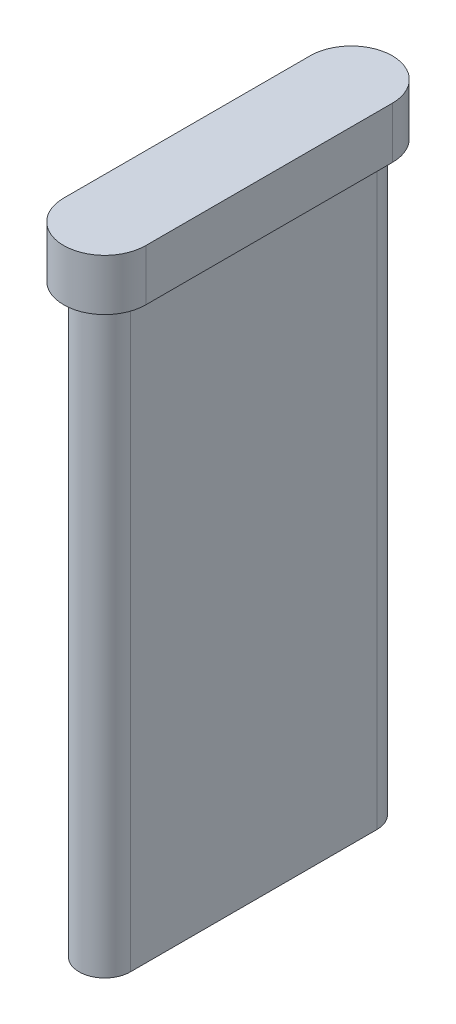
from build123d import *

# Parameters (mm, degrees)
BOSS_EXTRUDE1_DEPTH = 62
BOSS_EXTRUDE2_DEPTH = 5


with BuildPart() as part:
    # Sketch1 → Boss-Extrude1 (new body)
    with BuildSketch(Plane(origin=(0, 0, 0), x_dir=(1, 0, 0), z_dir=(0, 1, 0))):
        with BuildLine():
            Line((-2.5, -12), (-2.5, 12))
            ThreePointArc((-2.5, 12), (0, 14.5), (2.5, 12))
            Line((2.5, 12), (2.5, -12))
            ThreePointArc((2.5, -12), (0, -14.5), (-2.5, -12))
        make_face()
    extrude(amount=-BOSS_EXTRUDE1_DEPTH)

    # Sketch2 → Boss-Extrude2 (add)
    with BuildSketch(Plane(origin=(0, 0, 0), x_dir=(1, 0, 0), z_dir=(0, 1, 0))):
        with BuildLine():
            Line((4, -12), (4, 12))
            ThreePointArc((4, 12), (0, 16), (-4, 12))
            Line((-4, 12), (-4, -12))
            ThreePointArc((-4, -12), (0, -16), (4, -12))
        make_face()
    extrude(amount=-BOSS_EXTRUDE2_DEPTH)


solid = part.part
